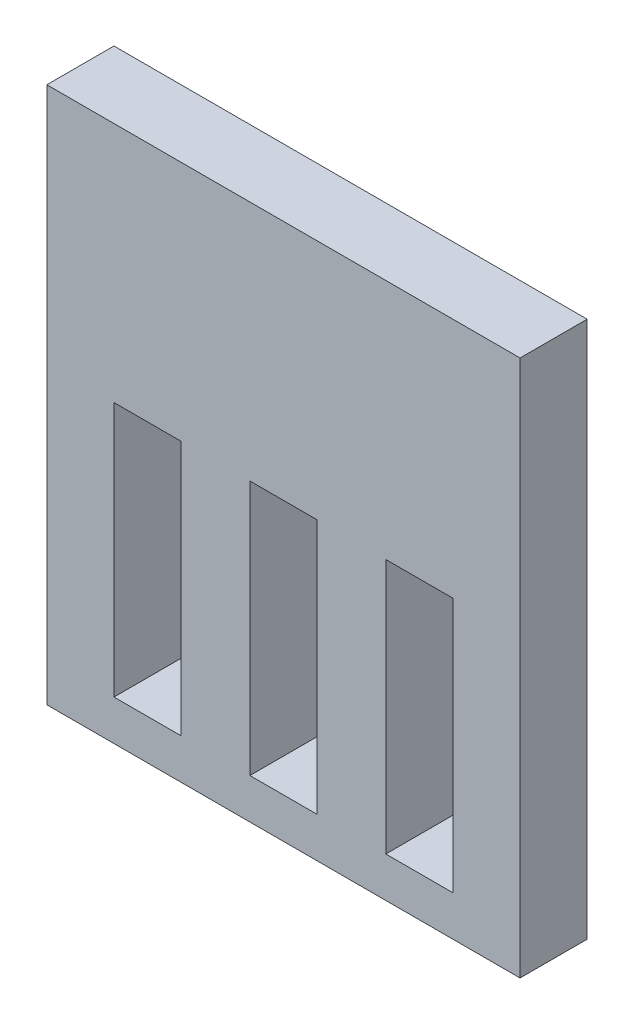
from build123d import *

# Parameters (mm, degrees)
SKETCH2_W           = 70.5
SKETCH2_H           = 80
BOSS_EXTRUDE1_DEPTH = 10
SKETCH5_W           = 10
SKETCH5_H           = 68
CUT_EXTRUDE2_DEPTH  = 10
SKETCH8_W           = 50.5
SKETCH8_H           = 30
BOSS_EXTRUDE3_DEPTH = 10


with BuildPart() as part:
    # Sketch2 → Boss-Extrude1 (new body)
    with BuildSketch(Plane.XY):
        with Locations((0, 40)):
            Rectangle(SKETCH2_W, SKETCH2_H)
    extrude(amount=BOSS_EXTRUDE1_DEPTH)

    # Sketch5 → Cut-Extrude2 (cut)
    with BuildSketch(Plane.XY.offset(10)):
        with Locations((20.25, 40)):
            Rectangle(SKETCH5_W, SKETCH5_H)
        with Locations((-20.25, 40)):
            Rectangle(SKETCH5_W, SKETCH5_H)
        with Locations((0, 40)):
            Rectangle(SKETCH5_W, SKETCH5_H)
    extrude(amount=-CUT_EXTRUDE2_DEPTH, mode=Mode.SUBTRACT)

    # Sketch8 → Boss-Extrude3 (add)
    with BuildSketch(Plane.XY.offset(10)):
        with Locations((0, 59)):
            Rectangle(SKETCH8_W, SKETCH8_H)
    extrude(amount=-BOSS_EXTRUDE3_DEPTH)


solid = part.part
